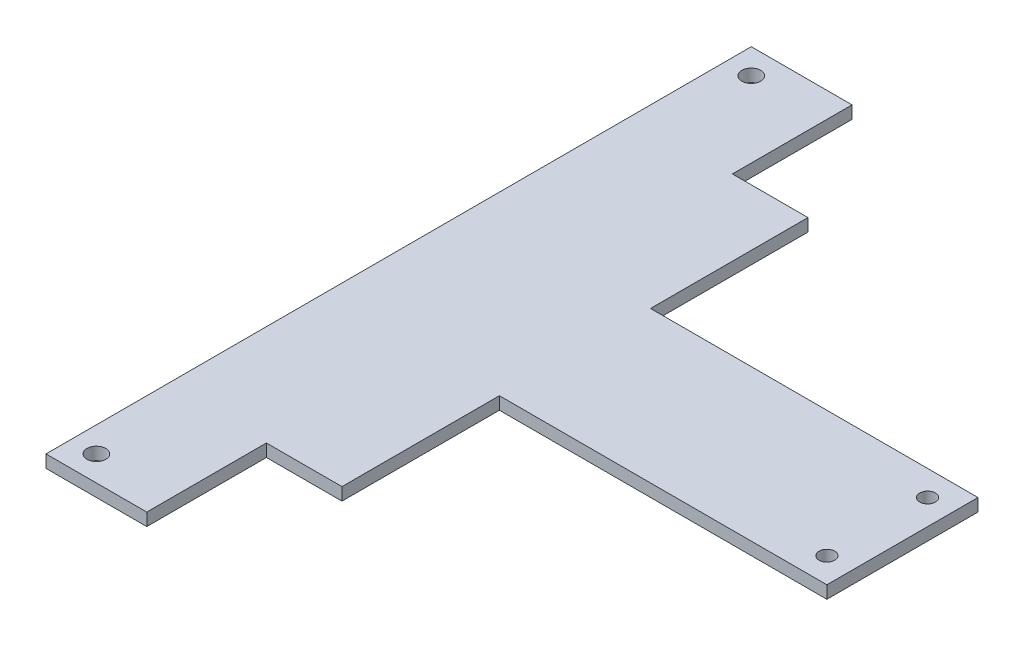
from build123d import *

# Parameters (mm, degrees)
SKETCH1_W                   = 165.1
SKETCH1_H                   = 38.1
BOSS_EXTRUDE1_DEPTH         = 3.175
F_1_4_0_25_DIAMETER_HOLE1_D = 7.9375
SKETCH4_W                   = 50.8
SKETCH4_H                   = 355.6
SKETCH4_R                   = 4.7625
BOSS_EXTRUDE2_DEPTH         = 6.35
CUT_EXTRUDE1_REACH          = 272.08
SKETCH5_W                   = 38.1
SKETCH5_H                   = 60.325


with BuildPart() as part:
    # Sketch1 → Boss-Extrude1 (new, symmetric)
    with BuildSketch(Plane(origin=(0, 0, 0), x_dir=(1, 0, 0), z_dir=(0, 1, 0))):
        Polygon((0, 0), (0, -177.8), (38.1, -177.8), (38.1, -38.1), (38.1, 0), align=None)
        with Locations((120.65, -19.05)):
            Rectangle(SKETCH1_W, SKETCH1_H)
        with Locations((120.65, 19.05)):
            Rectangle(SKETCH1_W, SKETCH1_H)
        Polygon((0, 177.8), (0, 0), (38.1, 0), (38.1, 38.1), (38.1, 177.8), align=None)
    extrude(amount=BOSS_EXTRUDE1_DEPTH, both=True)

    # 1/4 (0.25) Diameter Hole1 (through all)
    with Locations(Plane(origin=(0, 3.175, 0), x_dir=(1, 0, 0), z_dir=(0, 1, 0))):
        with Locations((190.5, 25.4), (190.5, -25.4)):
            Hole(F_1_4_0_25_DIAMETER_HOLE1_D / 2)

    # Sketch4 → Boss-Extrude2 (add)
    with BuildSketch(Plane.XZ.offset(3.175)):
        with Locations((-25.4, 0)):
            Rectangle(SKETCH4_W, SKETCH4_H)
        with Locations(Location((-38.1, -165.1, 0), (0, 0, 270))):
            Circle(SKETCH4_R, mode=Mode.SUBTRACT)
        with Locations(Location((-38.1, 165.1, 0), (0, 0, 270))):
            Circle(SKETCH4_R, mode=Mode.SUBTRACT)
    extrude(amount=-BOSS_EXTRUDE2_DEPTH)

    # Sketch5 → Cut-Extrude1 (cut, up to next)
    with BuildSketch(Plane.XZ.offset(3.175), mode=Mode.PRIVATE) as cut_extrude1_sk1:
        with Locations((19.05, 147.6375)):
            Rectangle(SKETCH5_W, SKETCH5_H)
    cut_extrude1_tool1 = extrude(cut_extrude1_sk1.sketch, amount=-CUT_EXTRUDE1_REACH, mode=Mode.PRIVATE) & part.part
    # Sketch5 → Cut-Extrude1 (cut, up to next)
    with BuildSketch(Plane.XZ.offset(3.175), mode=Mode.PRIVATE) as cut_extrude1_sk2:
        with Locations((19.05, -147.6375)):
            Rectangle(SKETCH5_W, SKETCH5_H)
    cut_extrude1_tool2 = extrude(cut_extrude1_sk2.sketch, amount=-CUT_EXTRUDE1_REACH, mode=Mode.PRIVATE) & part.part
    add(cut_extrude1_tool1.solids().sort_by_distance((19.05, -3.175, 147.6375))[0], mode=Mode.SUBTRACT)
    add(cut_extrude1_tool2.solids().sort_by_distance((19.05, -3.175, -147.6375))[0], mode=Mode.SUBTRACT)


solid = part.part
